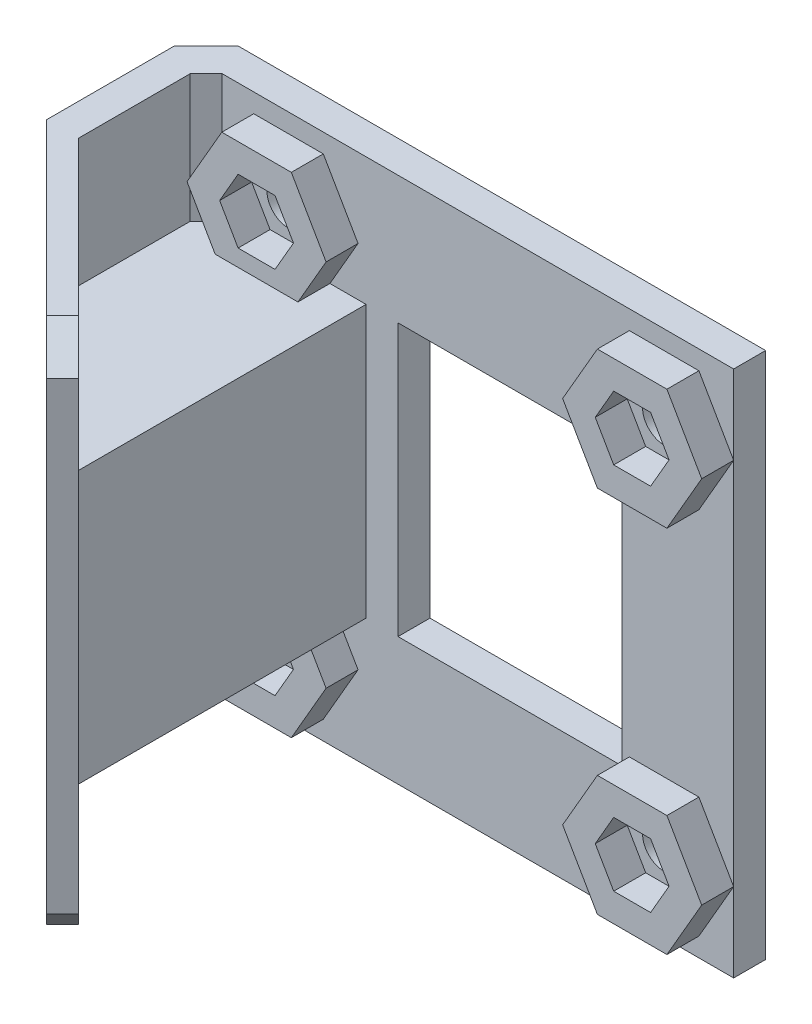
from build123d import *

# Parameters (mm, degrees)
SKETCH1_W                      = 33
SKETCH1_H                      = 33
SKETCH1_R                      = 1.35
BOSS_EXTRUDE1_DEPTH            = 2
SKETCH4_W                      = 10
SKETCH4_H                      = 33
BOSS_EXTRUDE3_DEPTH            = 2
BOSS_EXTRUDE4_DEPTH            = 33
SKETCH6_R                      = 1.65
CUT_EXTRUDE1_DEPTH             = 2
CHAMFER1_SIZE                  = 1
SKETCH7_W                      = 8
SKETCH7_H                      = 15
CUT_EXTRUDE3_DEPTH             = 2
CUT_EXTRUDE3_DIRECTION_2_REACH = 33.864
BOSS_EXTRUDE6_REACH            = 35.157
SKETCH9_W                      = 12
SKETCH9_H                      = 17
SKETCH9_W_2                    = 8
SKETCH9_H_2                    = 15
SKETCH10_W                     = 14
SKETCH10_H                     = 17
CUT_EXTRUDE4_DEPTH             = 2
BOSS_EXTRUDE8_DEPTH            = 2
CHAMFER3_SIZE                  = 2
CHAMFER4_SIZE                  = 2


with BuildPart() as part:
    # Sketch1 → Boss-Extrude1 (new body)
    with BuildSketch(Plane.XY):
        Rectangle(SKETCH1_W, SKETCH1_H)
        with Locations((-11.35, 11.55)):
            Circle(SKETCH1_R, mode=Mode.SUBTRACT)
        with Locations((12.15, 11.55)):
            Circle(SKETCH1_R, mode=Mode.SUBTRACT)
        with Locations((-11.35, -11.55)):
            Circle(SKETCH1_R, mode=Mode.SUBTRACT)
        with Locations((12.15, -11.55)):
            Circle(SKETCH1_R, mode=Mode.SUBTRACT)
    extrude(amount=BOSS_EXTRUDE1_DEPTH)

    # Sketch4 → Boss-Extrude3 (add)
    with BuildSketch(Plane.ZY.offset(16.5)):
        with Locations((5, 0)):
            Rectangle(SKETCH4_W, SKETCH4_H)
    extrude(amount=BOSS_EXTRUDE3_DEPTH)

    # Sketch5 → Boss-Extrude4 (add)
    with BuildSketch(Plane.XZ.offset(16.5)):
        Polygon((-18.5, 10), (-6.47918472, 22.02081528), (-5.47918472, 21.02081528), (-16.5, 10), align=None)
    extrude(amount=-BOSS_EXTRUDE4_DEPTH)

    # Sketch6 → Cut-Extrude1 (cut)
    with BuildSketch(Plane(origin=(-13.25, 0, 13.25), x_dir=(-0.7071067811865435, 0, -0.7071067811865517), z_dir=(0.7071067811865517, 0, -0.7071067811865435))):
        with Locations((-5.98959236, 13.5)):
            Circle(SKETCH6_R)
        with Locations((-5.98959236, -13.5)):
            Circle(SKETCH6_R)
    extrude(amount=-CUT_EXTRUDE1_DEPTH, mode=Mode.SUBTRACT)

    # Chamfer1
    chamfer1_edges = [part.edges().sort_by_distance(p)[0] for p in [
        (-16.5, 0, 2),
    ]]
    chamfer(chamfer1_edges, length=CHAMFER1_SIZE)

    # Sketch7 → Cut-Extrude3 (cut)
    with BuildSketch(Plane.XY.offset(2)):
        with Locations((-11.5, 0)):
            Rectangle(SKETCH7_W, SKETCH7_H)
    extrude(amount=-CUT_EXTRUDE3_DEPTH, mode=Mode.SUBTRACT)

    # Cut-Extrude3 direction 2: up to this plane
    cut_extrude3_direction_2_end = Plane(origin=(-18.5, 34.221219782, 10), z_dir=(-0.7071067811865515, 0, 0.7071067811865437))
    # Sketch7 → Cut-Extrude3 direction 2 (cut, up to the surface)
    with BuildSketch(Plane.XY.offset(2), mode=Mode.PRIVATE) as cut_extrude3_direction_2_sk1:
        with Locations((-11.5, 0)):
            Rectangle(SKETCH7_W, SKETCH7_H)
    cut_extrude3_direction_2_tool1 = split(extrude(cut_extrude3_direction_2_sk1.sketch, amount=CUT_EXTRUDE3_DIRECTION_2_REACH, mode=Mode.PRIVATE), bisect_by=cut_extrude3_direction_2_end, keep=Keep.BOTH, mode=Mode.PRIVATE)
    add(cut_extrude3_direction_2_tool1.solids().sort_by_distance((-11.5, 0, 2))[0], mode=Mode.SUBTRACT)

    # Boss-Extrude6: up to this plane
    boss_extrude6_end = Plane(origin=(-5.47918472, 34.221219782, 21.02081528), z_dir=(0.7071067811865513, 0, -0.7071067811865438))
    # Sketch9 → Boss-Extrude6 (add, up to the surface)
    with BuildSketch(Plane(origin=(0, 0, 0), x_dir=(-1, 0, 0), z_dir=(0, 0, -1)), mode=Mode.PRIVATE) as boss_extrude6_sk1:
        with Locations((12.5, 0)):
            Rectangle(SKETCH9_W, SKETCH9_H)
        with Locations((11.5, 0)):
            Rectangle(SKETCH9_W_2, SKETCH9_H_2, mode=Mode.SUBTRACT)
    boss_extrude6_tool1 = split(extrude(boss_extrude6_sk1.sketch, amount=-BOSS_EXTRUDE6_REACH, mode=Mode.PRIVATE), bisect_by=boss_extrude6_end, keep=Keep.BOTH, mode=Mode.PRIVATE)
    add(boss_extrude6_tool1.solids().sort_by_distance((-12.5, -8.291913, 0))[0])

    # Sketch10 → Cut-Extrude4 (cut)
    with BuildSketch(Plane(origin=(0, 0, 0), x_dir=(-1, 0, 0), z_dir=(0, 0, -1))):
        with Locations((-2.5, 0)):
            Rectangle(SKETCH10_W, SKETCH10_H)
    extrude(amount=-CUT_EXTRUDE4_DEPTH, mode=Mode.SUBTRACT)

    # Sketch12 → Boss-Extrude8 (add)
    # profile 1 of 4: a face of its own
    with BuildSketch(Plane.XY.offset(2)):
        Polygon((9.975, 15.317210506), (7.8, 11.55), (9.975, 7.782789494), (14.325, 7.782789494), (16.5, 11.55), (14.325, 15.317210506), align=None)
        Polygon((14.459401077, 11.55), (13.304700538, 13.55), (10.995299462, 13.55), (9.840598923, 11.55), (10.995299462, 9.55), (13.304700538, 9.55), align=None, mode=Mode.SUBTRACT)
    # profile 2 of 4: a face of its own
    with BuildSketch(Plane.XY.offset(2)):
        Polygon((9.975, -7.782789494), (7.8, -11.55), (9.975, -15.317210506), (14.325, -15.317210506), (16.5, -11.55), (14.325, -7.782789494), align=None)
        Polygon((14.459401077, -11.55), (13.304700538, -9.55), (10.995299462, -9.55), (9.840598923, -11.55), (10.995299462, -13.55), (13.304700538, -13.55), align=None, mode=Mode.SUBTRACT)
    # profile 3 of 4: a face of its own
    with BuildSketch(Plane.XY.offset(2)):
        Polygon((-9.175, -7.782789494), (-13.525, -7.782789494), (-15.7, -11.55), (-13.525, -15.317210506), (-9.175, -15.317210506), (-7, -11.55), align=None)
        Polygon((-9.040598923, -11.55), (-10.195299462, -9.55), (-12.504700538, -9.55), (-13.659401077, -11.55), (-12.504700538, -13.55), (-10.195299462, -13.55), align=None, mode=Mode.SUBTRACT)
    # profile 4 of 4: a face of its own
    with BuildSketch(Plane.XY.offset(2)):
        Polygon((-9.175, 15.317210506), (-13.525, 15.317210506), (-15.7, 11.55), (-13.525, 7.782789494), (-9.175, 7.782789494), (-7, 11.55), align=None)
        Polygon((-9.040598923, 11.55), (-10.195299462, 13.55), (-12.504700538, 13.55), (-13.659401077, 11.55), (-12.504700538, 9.55), (-10.195299462, 9.55), align=None, mode=Mode.SUBTRACT)
    extrude(amount=BOSS_EXTRUDE8_DEPTH)

    # Chamfer3
    chamfer3_edges = [part.edges().sort_by_distance(p)[0] for p in [
        (-18.5, 0, 0),
    ]]
    chamfer(chamfer3_edges, length=CHAMFER3_SIZE)

    # Chamfer4
    chamfer4_edges = [part.edges().sort_by_distance(p)[0] for p in [
        (-5.97918472, -16.5, 21.52081528),
        (-5.97918472, 16.5, 21.52081528),
    ]]
    chamfer(chamfer4_edges, length=CHAMFER4_SIZE)


solid = part.part
